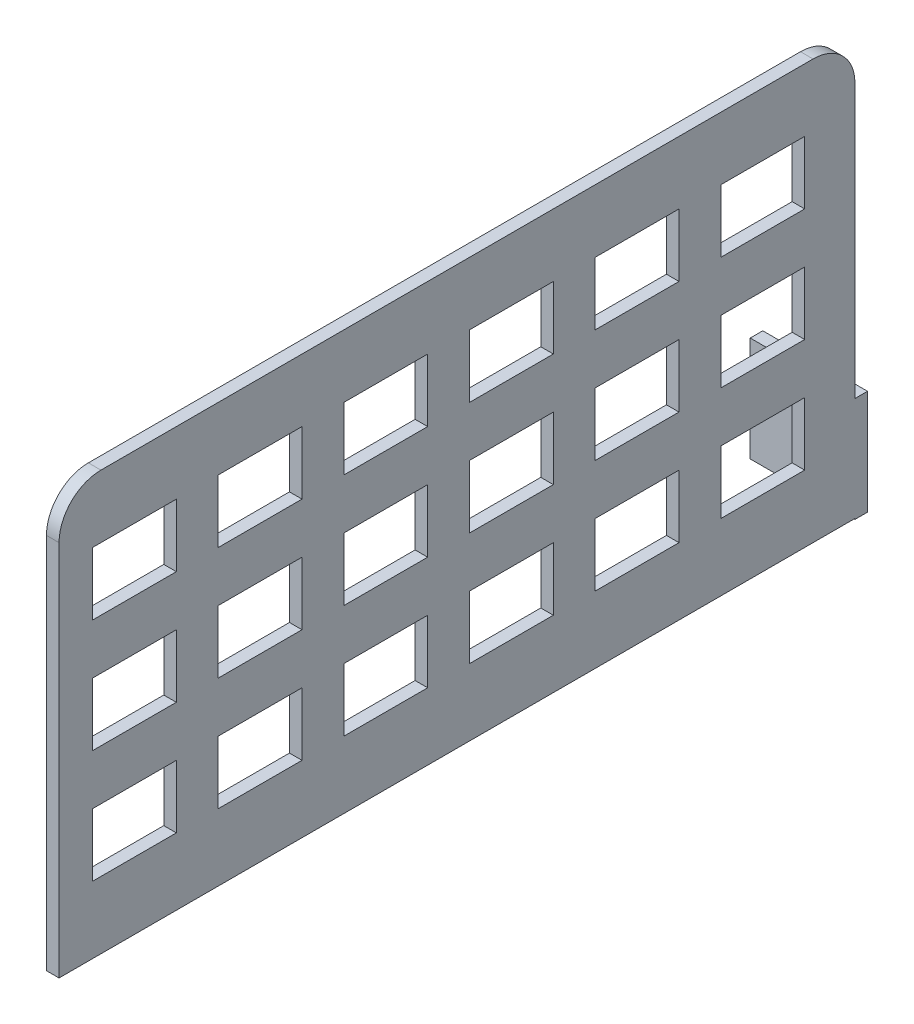
from build123d import *

# Parameters (mm, degrees)
SKETCH_1_W          = 25
SKETCH_1_H          = 25
EXTRUDE_1_DEPTH     = 3
SKETCH_2_W          = 3
SKETCH_2_H          = 100
EXTRUDE_2_DEPTH     = 190
FILLET_1_R          = 10
SKETCH_3_W          = 20
SKETCH_3_H          = 15
CUT_EXTRUDE_2_DEPTH = 10
FILLET_2_R          = 10
FILLET_3_R          = 10


with BuildPart() as part:
    # 草图1 → 凸台-拉伸1 (new body)
    with BuildSketch(Plane.XY):
        with Locations((-100.141216583, -61.148491789)):
            Rectangle(SKETCH_1_W, SKETCH_1_H)
    extrude(amount=EXTRUDE_1_DEPTH)

    # 草图2 → 凸台-拉伸2 (add)
    with BuildSketch(Plane.XY.offset(3)):
        with Locations((-89.141216583, -23.452816851)):
            Rectangle(SKETCH_2_W, SKETCH_2_H)
    extrude(amount=EXTRUDE_2_DEPTH)

    # 圆角1
    fillet_1_edges = [part.edges().sort_by_distance(p)[0] for p in [
        (-90.641216583, -61.05065432, 3),
    ]]
    fillet(fillet_1_edges, radius=FILLET_1_R)

    # 草图3 → 切除-拉伸2 (cut)
    with BuildSketch(Plane(origin=(-87.641216583, 0, 0), x_dir=(0, 0, -1), z_dir=(1, 0, 0))):
        with Locations((-25, 4.047183149)):
            Rectangle(SKETCH_3_W, SKETCH_3_H)
        with Locations((-55, 4.047183149)):
            Rectangle(SKETCH_3_W, SKETCH_3_H)
        with Locations((-85, 4.047183149)):
            Rectangle(SKETCH_3_W, SKETCH_3_H)
        with Locations((-115, 4.047183149)):
            Rectangle(SKETCH_3_W, SKETCH_3_H)
        with Locations((-145, 4.047183149)):
            Rectangle(SKETCH_3_W, SKETCH_3_H)
        with Locations((-175, 4.047183149)):
            Rectangle(SKETCH_3_W, SKETCH_3_H)
        with Locations((-55, -22.952816851)):
            Rectangle(SKETCH_3_W, SKETCH_3_H)
        with Locations((-85, -22.952816851)):
            Rectangle(SKETCH_3_W, SKETCH_3_H)
        with Locations((-115, -22.952816851)):
            Rectangle(SKETCH_3_W, SKETCH_3_H)
        with Locations((-145, -22.952816851)):
            Rectangle(SKETCH_3_W, SKETCH_3_H)
        with Locations((-175, -22.952816851)):
            Rectangle(SKETCH_3_W, SKETCH_3_H)
        with Locations((-55, -49.952816851)):
            Rectangle(SKETCH_3_W, SKETCH_3_H)
        with Locations((-85, -49.952816851)):
            Rectangle(SKETCH_3_W, SKETCH_3_H)
        with Locations((-115, -49.952816851)):
            Rectangle(SKETCH_3_W, SKETCH_3_H)
        with Locations((-145, -49.952816851)):
            Rectangle(SKETCH_3_W, SKETCH_3_H)
        with Locations((-175, -49.952816851)):
            Rectangle(SKETCH_3_W, SKETCH_3_H)
        with Locations((-25, -22.952816851)):
            Rectangle(SKETCH_3_W, SKETCH_3_H)
        with Locations((-25, -49.952816851)):
            Rectangle(SKETCH_3_W, SKETCH_3_H)
    extrude(amount=-CUT_EXTRUDE_2_DEPTH, mode=Mode.SUBTRACT)

    # 圆角2
    fillet_2_edges = [part.edges().sort_by_distance(p)[0] for p in [
        (-89.141216583, 26.547183149, 193),
    ]]
    fillet(fillet_2_edges, radius=FILLET_2_R)

    # 圆角3
    fillet_3_edges = [part.edges().sort_by_distance(p)[0] for p in [
        (-89.141216583, 26.547183149, 3),
    ]]
    fillet(fillet_3_edges, radius=FILLET_3_R)


solid = part.part
